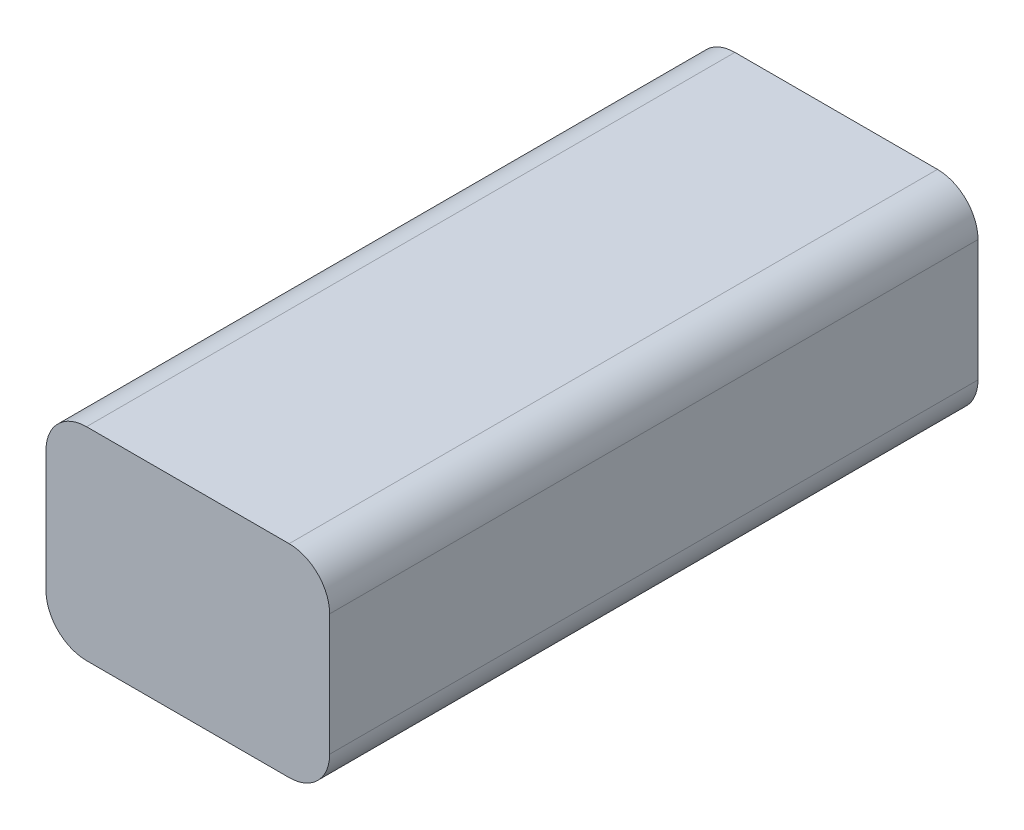
from build123d import *

# Parameters (mm, degrees)
BOSS_EXTRUDE1_DEPTH = 160


with BuildPart() as part:
    # Sketch1 → Boss-Extrude1 (new body)
    with BuildSketch(Plane.XY):
        with BuildLine():
            Line((-25, 25), (25, 25))
            ThreePointArc((25, 25), (32.071067812, 22.071067812), (35, 15))
            Line((35, 15), (35, -15))
            ThreePointArc((35, -15), (32.071067812, -22.071067812), (25, -25))
            Line((25, -25), (-25, -25))
            ThreePointArc((-25, -25), (-32.071067812, -22.071067812), (-35, -15))
            Line((-35, -15), (-35, 15))
            ThreePointArc((-35, 15), (-32.071067812, 22.071067812), (-25, 25))
        make_face()
    extrude(amount=BOSS_EXTRUDE1_DEPTH)


solid = part.part
